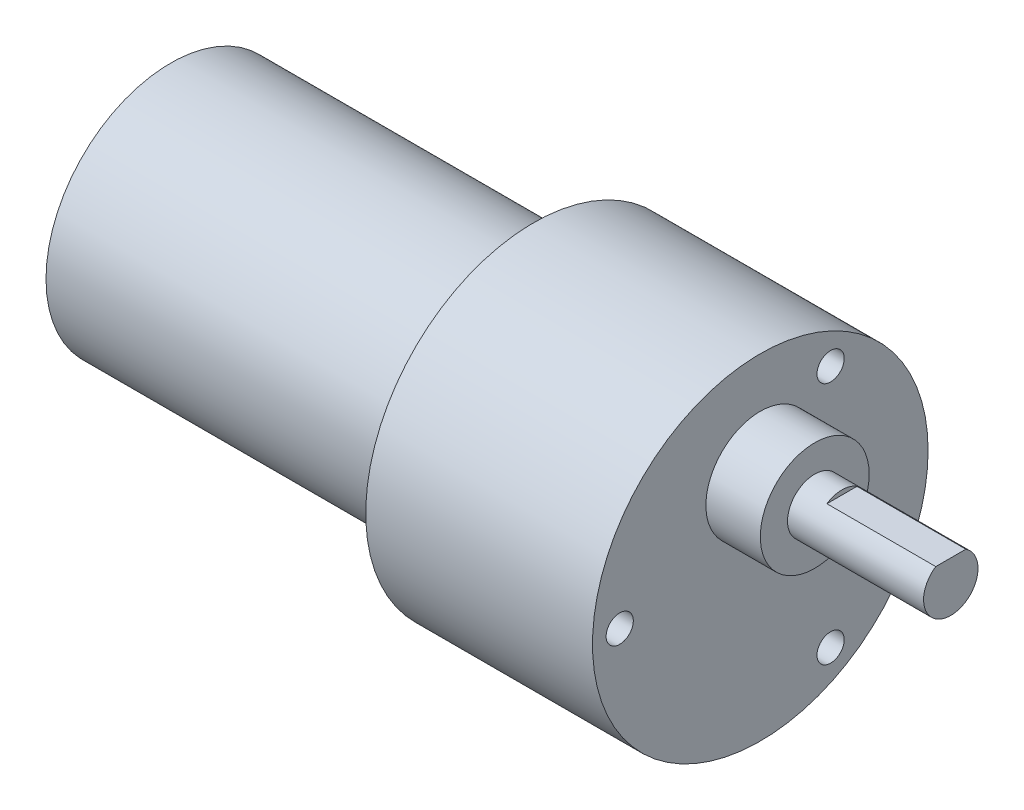
from build123d import *

# Parameters (mm, degrees)
SKETCH_1_R          = 13.75
EXTRUDE_1_DEPTH     = 20
SKETCH_2_R          = 5.1
EXTRUDE_2_DEPTH     = 3
SKETCH_3_R          = 18.5
EXTRUDE_3_DEPTH     = 25
SKETCH_4_R          = 6
EXTRUDE_4_DEPTH     = 6
SKETCH_5_R          = 3
EXTRUDE_5_DEPTH     = 15
CUT_EXTRUDE_1_DEPTH = 12
SKETCH_7_R          = 1.5
CUT_EXTRUDE_2_DEPTH = 3
CHAMFER_1_SIZE      = 2


with BuildPart() as part:
    # ｽｹｯﾁ1 → ﾎﾞｽ - 押し出し1 (new, symmetric)
    with BuildSketch(Plane(origin=(0, 0, 0), x_dir=(0, 0, -1), z_dir=(1, 0, 0))):
        Circle(SKETCH_1_R)
    extrude(amount=EXTRUDE_1_DEPTH, both=True)

    # ｽｹｯﾁ2 → ﾎﾞｽ - 押し出し2 (add)
    with BuildSketch(Plane.ZY.offset(20)):
        Circle(SKETCH_2_R)
    extrude(amount=EXTRUDE_2_DEPTH)

    # ｽｹｯﾁ3 → ﾎﾞｽ - 押し出し3 (add)
    with BuildSketch(Plane(origin=(20, 0, 0), x_dir=(0, 0, -1), z_dir=(1, 0, 0))):
        Circle(SKETCH_3_R)
    extrude(amount=EXTRUDE_3_DEPTH)

    # ｽｹｯﾁ4 → ﾎﾞｽ - 押し出し4 (add)
    with BuildSketch(Plane(origin=(45, 0, 0), x_dir=(0, 0, -1), z_dir=(1, 0, 0))):
        with Locations((0, 7)):
            Circle(SKETCH_4_R)
    extrude(amount=EXTRUDE_4_DEPTH)

    # ｽｹｯﾁ5 → ﾎﾞｽ - 押し出し5 (add)
    with BuildSketch(Plane(origin=(51, 0, 0), x_dir=(0, 0, -1), z_dir=(1, 0, 0))):
        with Locations((0, 7)):
            Circle(SKETCH_5_R)
    extrude(amount=EXTRUDE_5_DEPTH)

    # ｽｹｯﾁ6 → ｶｯﾄ - 押し出し1 (cut)
    with BuildSketch(Plane(origin=(66, 0, 0), x_dir=(0, 0, -1), z_dir=(1, 0, 0))):
        Polygon((-80.661429966, 9.5), (-1.658312395, 9.5), (1.658312395, 9.5), (80.661429966, 9.5), (80.661429966, 167.506235142), (-80.661429966, 167.506235142), align=None)
    extrude(amount=-CUT_EXTRUDE_1_DEPTH, mode=Mode.SUBTRACT)

    # ｽｹｯﾁ7 → ｶｯﾄ - 押し出し2 (cut)
    with BuildSketch(Plane(origin=(45, 0, 0), x_dir=(0, 0, -1), z_dir=(1, 0, 0))):
        with Locations((-15.5, 0)):
            Circle(SKETCH_7_R)
        with Locations((7.75, 13.423393759)):
            Circle(SKETCH_7_R)
        with Locations((7.75, -13.423393759)):
            Circle(SKETCH_7_R)
    extrude(amount=-CUT_EXTRUDE_2_DEPTH, mode=Mode.SUBTRACT)

    # 面取り1
    chamfer_1_edges = [part.edges().sort_by_distance(p)[0] for p in [
        (20, 0, 13.75),
    ]]
    chamfer(chamfer_1_edges, length=CHAMFER_1_SIZE)


solid = part.part
